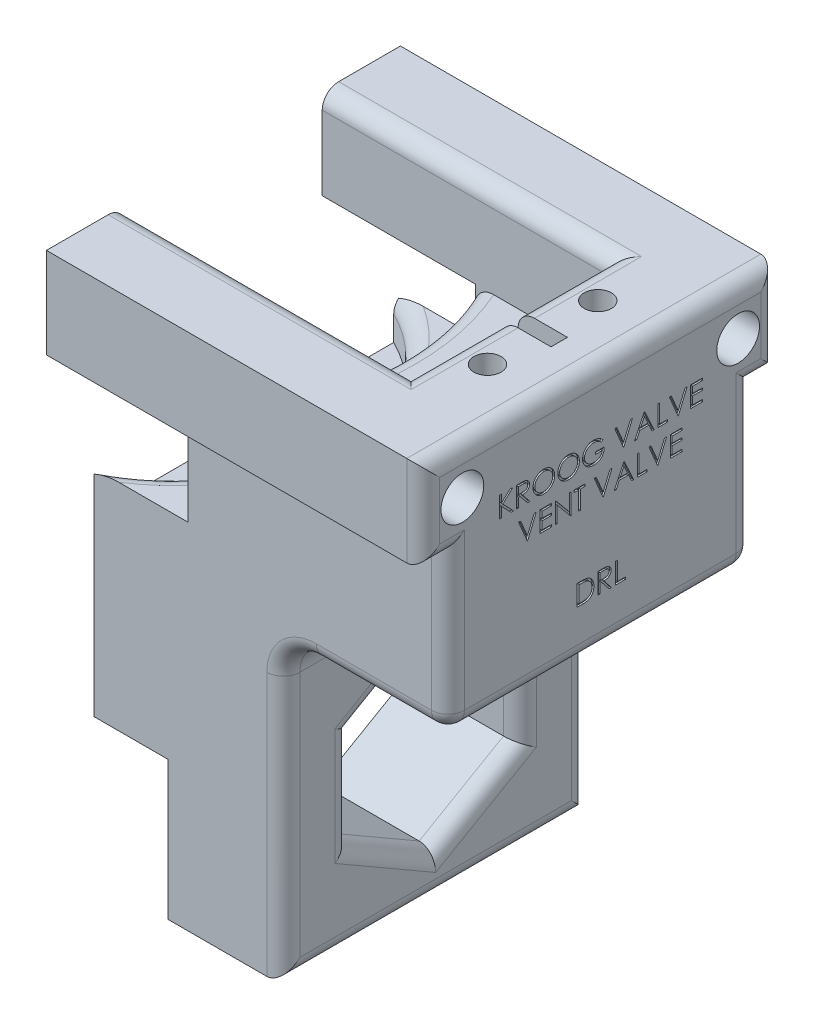
from build123d import *

# Parameters (mm, degrees)
BOSS_EXTRUDE1_DEPTH             = 17.78
BOSS_EXTRUDE2_DEPTH             = 11.43
CUT_EXTRUDE1_START              = -13.97
SKETCH5_R                       = 34.925
CUT_EXTRUDE1_DEPTH              = 15.24
CUT_EXTRUDE2_START              = -35.56
SKETCH5_3_R                     = 25.4
CUT_EXTRUDE2_DEPTH              = 6.35
SKETCH6_W                       = 54.61
SKETCH6_H                       = 13.97
BOSS_EXTRUDE3_DEPTH             = 3.530092
BOSS_EXTRUDE4_DEPTH             = 25.4
SKETCH7_W                       = 44.196
SKETCH7_H                       = 30.48
CUT_EXTRUDE3_DEPTH              = 13.97
SKETCH8_W                       = 7.62
SKETCH8_H                       = 2.54
CUT_EXTRUDE4_DEPTH              = 2.54
TAP_DRILL_FOR_M5X0_8_TAP1_D     = 4.2
TAP_DRILL_FOR_M5X0_8_TAP1_DEPTH = 7.874
TAP_DRILL_FOR_M5X0_8_TAP1_TIP   = 1.2618073
BOSS_EXTRUDE5_DEPTH             = 11.43
FILLET3_R                       = 2.54
FILLET4_R                       = 2.54
FILLET5_R                       = 5.08
FILLET6_R                       = 2.54
FILLET7_R                       = 2.54
SKETCH15_R                      = 3.302
CUT_EXTRUDE7_DEPTH              = 90.579142661
CUT_EXTRUDE8_DEPTH              = 0.254


with BuildPart() as part:
    # Sketch2 → Boss-Extrude1 (new body)
    with BuildSketch(Plane(origin=(0, 0, 0), x_dir=(0, 0, -1), z_dir=(1, 0, 0))):
        Polygon((-23.495, -21.381314258), (23.495, -21.381314258), (23.495, 48.468685742), (27.305, 48.468685742), (27.305, 62.438685742), (23.495, 62.438685742), (-23.495, 62.438685742), (-27.305, 62.438685742), (-27.305, 48.468685742), (-23.495, 48.468685742), align=None)
        Polygon((0, 15.031314258), (-13.0175, 7.515657129), (-13.0175, -7.515657129), (0, -15.031314258), (13.0175, -7.515657129), (13.0175, 7.515657129), align=None, mode=Mode.SUBTRACT)
    extrude(amount=BOSS_EXTRUDE1_DEPTH)

    # Sketch4 → Boss-Extrude2 (add)
    with BuildSketch(Plane.ZY):
        Polygon((-23.495, 16.301314258), (23.495, 16.301314258), (23.495, 48.468685742), (27.305, 48.468685742), (27.305, 62.438685742), (-27.305, 62.438685742), (-27.305, 48.468685742), (-23.495, 48.468685742), align=None)
    extrude(amount=BOSS_EXTRUDE2_DEPTH)

    # Sketch5 → Cut-Extrude1 (cut)
    with BuildSketch(Plane(origin=(0, 62.438685742, 0), x_dir=(1, 0, 0), z_dir=(0, 1, 0)).offset(CUT_EXTRUDE1_START)):
        with Locations((-22.73046, 0)):
            Circle(SKETCH5_R)
    extrude(amount=-CUT_EXTRUDE1_DEPTH, mode=Mode.SUBTRACT)

    # Sketch5<3> → Cut-Extrude2 (cut)
    with BuildSketch(Plane(origin=(0, 62.438685742, 0), x_dir=(1, 0, 0), z_dir=(0, 1, 0)).offset(CUT_EXTRUDE2_START)):
        with Locations((-22.73046, 0)):
            Circle(SKETCH5_3_R)
    extrude(amount=CUT_EXTRUDE2_DEPTH, mode=Mode.SUBTRACT)

    # Sketch6 → Boss-Extrude3 (add)
    with BuildSketch(Plane.ZY.offset(11.43)):
        with Locations((0, 55.453685742)):
            Rectangle(SKETCH6_W, SKETCH6_H)
    extrude(amount=BOSS_EXTRUDE3_DEPTH)

    # Sketch11 → Boss-Extrude4 (add)
    with BuildSketch(Plane(origin=(17.78, 0, 0), x_dir=(0, 0, -1), z_dir=(1, 0, 0))):
        Polygon((-23.495, 48.468685742), (-23.495, 24.338685742), (23.495, 24.338685742), (23.495, 48.468685742), (27.305, 48.468685742), (27.305, 62.438685742), (-27.305, 62.438685742), (-27.305, 48.468685742), align=None)
    extrude(amount=BOSS_EXTRUDE4_DEPTH)

    # Sketch7 → Cut-Extrude3 (cut)
    with BuildSketch(Plane(origin=(0, 62.438685742, 0), x_dir=(1, 0, 0), z_dir=(0, 1, 0))):
        with Locations((7.137908, 0)):
            Rectangle(SKETCH7_W, SKETCH7_H)
    extrude(amount=-CUT_EXTRUDE3_DEPTH, mode=Mode.SUBTRACT)

    # Sketch8 → Cut-Extrude4 (cut)
    with BuildSketch(Plane(origin=(0, 62.438685742, 0), x_dir=(1, 0, 0), z_dir=(0, 1, 0))):
        with Locations((33.045908, 0)):
            Rectangle(SKETCH8_W, SKETCH8_H)
    extrude(amount=-CUT_EXTRUDE4_DEPTH, mode=Mode.SUBTRACT)

    # Tap Drill for M5x0.8 Tap1
    with Locations(Plane(origin=(0, 62.438685742, 0), x_dir=(1, 0, 0), z_dir=(0, 1, 0))):
        with Locations((34.29, -8.509), (34.29, 8.509)):
            Hole(TAP_DRILL_FOR_M5X0_8_TAP1_D / 2, depth=TAP_DRILL_FOR_M5X0_8_TAP1_DEPTH)
            with Locations((0, 0, -(TAP_DRILL_FOR_M5X0_8_TAP1_DEPTH + TAP_DRILL_FOR_M5X0_8_TAP1_TIP / 2))):  # 118° drill point
                Cone(0, TAP_DRILL_FOR_M5X0_8_TAP1_D / 2, TAP_DRILL_FOR_M5X0_8_TAP1_TIP, mode=Mode.SUBTRACT)

    # Sketch12 → Boss-Extrude5 (add)
    with BuildSketch(Plane.ZY):
        with BuildLine():
            Line((-23.495, 16.301314258), (23.495, 16.301314258))
            Line((23.495, 16.301314258), (23.495, 0))
            Line((23.495, 0), (15.494, 0))
            ThreePointArc((15.494, 0), (0, 15.494), (-15.494, 0))
            Line((-15.494, 0), (-23.495, 0))
            Line((-23.495, 0), (-23.495, 16.301314258))
        make_face()
    extrude(amount=BOSS_EXTRUDE5_DEPTH)

    # Fillet3
    fillet3_edges = [part.edges().sort_by_distance(p)[0] for p in [
        (2.66954, 33.228685742, 0),
        (12.19454, 48.468685742, 0),
    ]]
    fillet(fillet3_edges, radius=FILLET3_R)

    # Fillet4
    fillet4_edges = [part.edges().sort_by_distance(p)[0] for p in [
        (-5.715, 0, -15.494),
        (-5.715, 0, 15.494),
        (-11.43, 15.494, 0),
    ]]
    fillet(fillet4_edges, radius=FILLET4_R)

    # Fillet5
    fillet5_edges = [part.edges().sort_by_distance(p)[0] for p in [
        (17.78, 24.338685742, 0),
    ]]
    fillet(fillet5_edges, radius=FILLET5_R)

    # Fillet6
    fillet6_edges = [part.edges().sort_by_distance(p)[0] for p in [
        (17.78, -1.061314258, -23.495),
        (33.02, 24.338685742, -23.495),
        (33.02, 24.338685742, 23.495),
        (43.18, 36.403685742, -23.495),
        (43.18, 48.468685742, -25.4),
        (43.18, 55.453685742, -27.305),
        (43.18, 62.438685742, 0),
        (43.18, 55.453685742, 27.305),
        (43.18, 48.468685742, 25.4),
        (43.18, 36.403685742, 23.495),
        (43.18, 24.338685742, 0),
        (17.78, -1.061314258, 23.495),
        (19.267897552, 22.85078819, -23.495),
        (19.267897552, 22.85078819, 23.495),
        (17.78, 11.273485694, -6.50875),
        (17.78, 11.273485694, 6.50875),
        (17.78, 0, 13.0175),
        (17.78, -11.273485694, 6.50875),
        (17.78, -11.273485694, -6.50875),
        (17.78, 0, -13.0175),
        (17.78, -21.381314258, 0),
    ]]
    fillet(fillet6_edges, radius=FILLET6_R)

    # Fillet7
    fillet7_edges = [part.edges().sort_by_distance(p)[0] for p in [
        (29.235908, 62.438685742, 8.255),
        (7.137908, 62.438685742, 15.24),
        (29.235908, 62.438685742, -8.255),
        (7.137908, 62.438685742, -15.24),
    ]]
    fillet(fillet7_edges, radius=FILLET7_R)

    # Sketch15 → Cut-Extrude7 (cut, through all)
    with BuildSketch(Plane.ZY.offset(14.960092)):
        with Locations((-21.2725, 55.453685742)):
            Circle(SKETCH15_R)
        with Locations(Location((21.2725, 55.453685742, 0), (0, 0, 180))):
            Circle(SKETCH15_R)
    extrude(amount=-CUT_EXTRUDE7_DEPTH, mode=Mode.SUBTRACT)

    # Sketch16 → Cut-Extrude8 (cut)
    # profile 1 of 22: a face of its own
    with BuildSketch(Plane(origin=(43.18, 0, 0), x_dir=(0, 0, -1), z_dir=(1, 0, 0))):
        Polygon((-15.508653846, 52.913685742), (-15.223717949, 52.913685742), (-15.223717949, 51.70461623), (-13.900165264, 52.913685742), (-13.49375, 52.913685742), (-15.053901242, 51.489006254), (-13.371634615, 49.738685742), (-13.751973157, 49.738685742), (-15.223717949, 51.270852208), (-15.223717949, 49.738685742), (-15.508653846, 49.738685742), align=None)
    # profile 2 of 22: a face of its own
    with BuildSketch(Plane(origin=(43.18, 0, 0), x_dir=(0, 0, -1), z_dir=(1, 0, 0))):
        with BuildLine():
            Line((-12.903525641, 52.913685742), (-12.26814403, 52.913685742))
            add(Edge.make_bspline(
                [(-12.26814403, 52.913685742), (-12.22574315, 52.913544603), (-12.144328761, 52.913273601), (-12.027694438, 52.911762516), (-11.921715571, 52.907431493), (-11.826447574, 52.903704421), (-11.741892194, 52.89690816), (-11.667790152, 52.89041243), (-11.60448274, 52.881909181), (-11.566159718, 52.874012119), (-11.548808093, 52.870436543)],
                knots=[0, 0, 0, 0, 1.410062039, 2.707475311, 3.878576406, 4.937260626, 5.877586885, 6.699081471, 7.410979367, 8, 8, 8, 8], degree=3))
            add(Edge.make_bspline(
                [(-11.548808093, 52.870436543), (-11.525579227, 52.864697263), (-11.479617029, 52.853341137), (-11.413440898, 52.829338499), (-11.350381475, 52.801562126), (-11.290700706, 52.768937894), (-11.234697524, 52.731223629), (-11.181794485, 52.689070404), (-11.131751529, 52.642708867), (-11.086592479, 52.590970118), (-11.044012053, 52.536689856), (-11.008099514, 52.477994305), (-10.977141921, 52.416615634), (-10.952494381, 52.351929619), (-10.932647933, 52.284563583), (-10.918654131, 52.213907317), (-10.910261982, 52.140282719), (-10.909407584, 52.090065187), (-10.908974359, 52.064602208)],
                knots=[0, 0, 0, 0, 1.027469482, 2.033020251, 3.019912614, 3.986113645, 4.951240523, 5.91722682, 6.890402269, 7.87763091, 8.8651537, 9.85103654, 10.82876324, 11.815024772, 12.821070561, 13.842952187, 14.906261191, 16, 16, 16, 16], degree=3))
            add(Edge.make_bspline(
                [(-10.908974359, 52.064602208), (-10.91030695, 52.022297506), (-10.912907181, 51.939750075), (-10.937150667, 51.81995199), (-10.976862225, 51.708201683), (-11.031584065, 51.604639861), (-11.101270304, 51.511285205), (-11.185022079, 51.429288149), (-11.282886112, 51.360671942), (-11.373989849, 51.313089755), (-11.454466301, 51.282616188), (-11.520717949, 51.261174634), (-11.592987279, 51.244608423), (-11.670581861, 51.229767446), (-11.753824606, 51.218562695), (-11.842515999, 51.210356141), (-11.936719293, 51.205227111), (-12.00143402, 51.204463292), (-12.034725561, 51.204070357)],
                knots=[0, 0, 0, 0, 1.260483769, 2.459530307, 3.627416485, 4.787058657, 5.939039949, 7.08810263, 8.267026773, 9.491475466, 10.141966685, 10.831826277, 11.566392101, 12.351337768, 13.187381173, 14.07005841, 15.007169909, 16, 16, 16, 16], degree=3))
            Line((-12.034725561, 51.204070357), (-10.868269231, 49.738685742))
            Line((-10.868269231, 49.738685742), (-11.220622997, 49.738685742))
            Line((-11.220622997, 49.738685742), (-12.387079327, 51.204070357))
            Line((-12.387079327, 51.204070357), (-12.618589744, 51.204070357))
            Line((-12.618589744, 51.204070357), (-12.618589744, 49.738685742))
            Line((-12.618589744, 49.738685742), (-12.903525641, 49.738685742))
            Line((-12.903525641, 49.738685742), (-12.903525641, 52.913685742))
        make_face()
        with BuildLine():
            Line((-12.618589744, 52.588044716), (-12.618589744, 51.529711383))
            Line((-12.618589744, 51.529711383), (-12.037269631, 51.525259259))
            add(Edge.make_bspline(
                [(-12.037269631, 51.525259259), (-12.010127882, 51.525247252), (-11.957519441, 51.525223978), (-11.881409552, 51.528846903), (-11.810543451, 51.532968342), (-11.745192197, 51.539272391), (-11.685326596, 51.547396828), (-11.630976572, 51.557559535), (-11.582053403, 51.56939962), (-11.524995443, 51.587725381), (-11.461280875, 51.616759412), (-11.392037337, 51.659000971), (-11.33307093, 51.712131529), (-11.283252584, 51.772886021), (-11.243220885, 51.839684619), (-11.214997808, 51.911726611), (-11.197088592, 51.987193275), (-11.194976269, 52.039061987), (-11.193910256, 52.065238226)],
                knots=[0, 0, 0, 0, 1.146690395, 2.22261258, 3.21895312, 4.145990853, 4.996080663, 5.770904154, 6.481378293, 7.121626537, 8.300444488, 9.431385265, 10.535395872, 11.636531494, 12.74115979, 13.810798291, 14.895190096, 16, 16, 16, 16], degree=3))
            add(Edge.make_bspline(
                [(-11.193910256, 52.065238226), (-11.195000752, 52.090771189), (-11.197161716, 52.141368205), (-11.214804528, 52.215441781), (-11.244639895, 52.285352515), (-11.284846497, 52.350816012), (-11.333831444, 52.410239072), (-11.391269746, 52.461081847), (-11.455590887, 52.503036718), (-11.515708331, 52.529846763), (-11.569442224, 52.546284059), (-11.616096273, 52.557851186), (-11.668811685, 52.567144383), (-11.727844422, 52.574590267), (-11.792942473, 52.580990109), (-11.864434992, 52.585300651), (-11.941847643, 52.587853228), (-11.995502359, 52.587979401), (-12.023277244, 52.588044716)],
                knots=[0, 0, 0, 0, 1.101028733, 2.181837193, 3.264309656, 4.369019818, 5.486613113, 6.575447106, 7.666700264, 8.788928104, 9.402425223, 10.0903467, 10.862060571, 11.710948788, 12.657782767, 13.684531032, 14.801375019, 16, 16, 16, 16], degree=3))
            Line((-12.023277244, 52.588044716), (-12.618589744, 52.588044716))
        make_face(mode=Mode.SUBTRACT)
    # profile 3 of 22: a face of its own
    with BuildSketch(Plane(origin=(43.18, 0, 0), x_dir=(0, 0, -1), z_dir=(1, 0, 0))):
        with BuildLine():
            add(Edge.make_bspline(
                [(-8.73125, 52.995095998), (-8.67245979, 52.993606942), (-8.556990966, 52.990682312), (-8.387287309, 52.96829484), (-8.225276044, 52.929564022), (-8.069637418, 52.877981173), (-7.922233075, 52.80917041), (-7.781953508, 52.725998882), (-7.649132487, 52.627595237), (-7.525560234, 52.514720153), (-7.412478572, 52.39190802), (-7.312850803, 52.260845916), (-7.229355294, 52.122326288), (-7.160788187, 51.976765392), (-7.106995877, 51.824492421), (-7.069876459, 51.664695575), (-7.046165422, 51.498410221), (-7.043393396, 51.384992993), (-7.041987179, 51.327457777)],
                knots=[0, 0, 0, 0, 1.065120563, 2.091984664, 3.0946048, 4.079830382, 5.057816894, 6.036188127, 7.030412546, 8.04752943, 9.064399622, 10.05169764, 11.02544977, 11.989514704, 12.962713494, 13.945757189, 14.957906945, 16, 16, 16, 16], degree=3))
            add(Edge.make_bspline(
                [(-7.041987179, 51.327457777), (-7.04339319, 51.270346379), (-7.046164599, 51.157773198), (-7.069903418, 50.992543073), (-7.107133468, 50.833710799), (-7.160288653, 50.681541528), (-7.228528908, 50.535874738), (-7.312580385, 50.397093716), (-7.411587055, 50.265152963), (-7.524260412, 50.141497903), (-7.6470885, 50.02810734), (-7.7788331, 49.92930236), (-7.916531325, 49.84428119), (-8.061955132, 49.776441714), (-8.21317588, 49.722220044), (-8.371546987, 49.685251586), (-8.536326361, 49.661405483), (-8.648695058, 49.658667258), (-8.705809295, 49.657275485)],
                knots=[0, 0, 0, 0, 1.043624062, 2.057103931, 3.04512605, 4.022047818, 4.998200453, 5.980619268, 6.982898556, 8.009068085, 9.034988726, 10.034168286, 11.015286542, 11.987931943, 12.962482838, 13.94673481, 14.956375938, 16, 16, 16, 16], degree=3))
            add(Edge.make_bspline(
                [(-8.705809295, 49.657275485), (-8.763344213, 49.658681), (-8.876760852, 49.661451645), (-9.043255162, 49.685201919), (-9.203164258, 49.722341531), (-9.356030848, 49.775417948), (-9.501940177, 49.844013579), (-9.64117761, 49.927656122), (-9.773184265, 50.026904029), (-9.896865706, 50.13954085), (-10.01003105, 50.262160758), (-10.108691341, 50.393546118), (-10.192352694, 50.531119282), (-10.260718002, 50.675262036), (-10.314842191, 50.82527756), (-10.351767276, 50.982166536), (-10.375657746, 51.145034516), (-10.378410786, 51.255926288), (-10.379807692, 51.312193354)],
                knots=[0, 0, 0, 0, 1.053102029, 2.075944431, 3.073151272, 4.055350789, 5.033113405, 6.020478099, 7.024410459, 8.052272461, 9.079885166, 10.07527673, 11.055994387, 12.023226415, 12.992069828, 13.970394897, 14.97016774, 16, 16, 16, 16], degree=3))
            add(Edge.make_bspline(
                [(-10.379807692, 51.312193354), (-10.379322702, 51.349960132), (-10.378358838, 51.425017244), (-10.366754946, 51.536474803), (-10.349916831, 51.6461399), (-10.325785096, 51.753700688), (-10.294224084, 51.858893867), (-10.256984031, 51.962444916), (-10.211500028, 52.063304437), (-10.160082583, 52.161950228), (-10.102695086, 52.256844543), (-10.039307799, 52.34654245), (-9.972147143, 52.43179664), (-9.89852035, 52.510397851), (-9.820854004, 52.584632668), (-9.737888189, 52.653360275), (-9.650129153, 52.717200409), (-9.55719928, 52.774731719), (-9.461388416, 52.826764648), (-9.362621625, 52.871415899), (-9.262240307, 52.909739112), (-9.159774305, 52.940800432), (-9.055495719, 52.96532235), (-8.949176957, 52.982020449), (-8.84090272, 52.993653938), (-8.767958167, 52.994613243), (-8.73125, 52.995095998)],
                knots=[0, 0, 0, 0, 1.037015668, 2.060948919, 3.074880161, 4.083647147, 5.086022904, 6.090072063, 7.104153813, 8.122640571, 9.144368836, 10.147691507, 11.138137339, 12.123020368, 13.103399296, 14.087645067, 15.080126199, 16.082011238, 17.087798457, 18.072939717, 19.057185487, 20.037253025, 21.01195951, 21.997135196, 22.992090687, 24, 24, 24, 24], degree=3))
        make_face()
        with BuildLine():
            add(Edge.make_bspline(
                [(-8.717257612, 52.669454972), (-8.74738803, 52.669087679), (-8.807360816, 52.668356604), (-8.896518931, 52.658726633), (-8.984504471, 52.645001663), (-9.071335607, 52.62542414), (-9.156649026, 52.598750464), (-9.241239954, 52.568051926), (-9.32433701, 52.530658508), (-9.405665867, 52.488410412), (-9.484510256, 52.441648176), (-9.558907492, 52.389966645), (-9.629050177, 52.334577813), (-9.694766568, 52.275352418), (-9.755863703, 52.211988851), (-9.813544111, 52.145447712), (-9.865495803, 52.073827068), (-9.913107719, 51.999069056), (-9.95571426, 51.92127105), (-9.993601403, 51.841252104), (-10.02459304, 51.758359488), (-10.049868195, 51.673492502), (-10.070823024, 51.586785557), (-10.084098083, 51.497580894), (-10.093833867, 51.406326757), (-10.094523155, 51.344657503), (-10.094871795, 51.313465389)],
                knots=[0, 0, 0, 0, 1.008559885, 2.007477868, 2.99961109, 3.989939068, 4.984837346, 5.991145699, 7.001802488, 8.033829008, 9.059044045, 10.069351652, 11.065060232, 12.050310815, 13.029377138, 14.011219647, 14.996725999, 15.989392538, 16.977580475, 17.965360261, 18.951710183, 19.937753436, 20.929683414, 21.935841486, 22.955955122, 24, 24, 24, 24], degree=3))
            add(Edge.make_bspline(
                [(-10.094871795, 51.313465389), (-10.093715313, 51.267598232), (-10.091440155, 51.177363343), (-10.071521502, 51.045130813), (-10.04084014, 50.918050725), (-9.995612386, 50.796818421), (-9.939051471, 50.680391822), (-9.869177078, 50.569803755), (-9.78639205, 50.465024334), (-9.692354423, 50.366785054), (-9.589554539, 50.277117789), (-9.480395562, 50.198410982), (-9.366046933, 50.131817398), (-9.246210456, 50.077565654), (-9.121525903, 50.034576392), (-8.991189839, 50.005113634), (-8.856070493, 49.985723042), (-8.763967684, 49.983860899), (-8.717257612, 49.982916511)],
                knots=[0, 0, 0, 0, 1.032063989, 2.030389145, 3.003944642, 3.970395727, 4.937377036, 5.913328081, 6.909231446, 7.93887556, 8.970685674, 9.976071282, 10.964166581, 11.944589148, 12.933237628, 13.927779006, 14.949070134, 16, 16, 16, 16], degree=3))
            add(Edge.make_bspline(
                [(-8.717257612, 49.982916511), (-8.68586185, 49.983347861), (-8.623594624, 49.984203359), (-8.5309794, 49.992820015), (-8.440032694, 50.006637497), (-8.350882069, 50.026531735), (-8.263628704, 50.051430272), (-8.177908418, 50.081010139), (-8.094634255, 50.117913803), (-8.012755688, 50.158688016), (-7.934381954, 50.205170159), (-7.859564864, 50.255097623), (-7.790190225, 50.310404872), (-7.724522996, 50.368750316), (-7.663175021, 50.431310378), (-7.606561157, 50.498003722), (-7.554872037, 50.569251318), (-7.507278201, 50.643895937), (-7.464820955, 50.721906823), (-7.427828487, 50.802215888), (-7.396444867, 50.88462538), (-7.371109724, 50.969254163), (-7.351256483, 51.055941504), (-7.337576842, 51.144803475), (-7.328007901, 51.235662307), (-7.327286652, 51.297115662), (-7.326923077, 51.328093795)],
                knots=[0, 0, 0, 0, 1.047197238, 2.076906641, 3.100256066, 4.114471768, 5.12198147, 6.126382909, 7.136867548, 8.15857795, 9.17633901, 10.174870724, 11.156907918, 12.133735059, 13.104061851, 14.077631395, 15.04955518, 16.038496417, 17.029181396, 18.010275684, 18.986308667, 19.968651475, 20.955262928, 21.950658345, 22.966943676, 24, 24, 24, 24], degree=3))
            add(Edge.make_bspline(
                [(-7.326923077, 51.328093795), (-7.327286944, 51.358860002), (-7.32800874, 51.419890442), (-7.337572271, 51.510115613), (-7.351270936, 51.598338169), (-7.371012821, 51.684211762), (-7.396458318, 51.767758281), (-7.427833967, 51.848899259), (-7.46483206, 51.927936979), (-7.507293807, 52.004676091), (-7.555023875, 52.078313175), (-7.607179367, 52.148709649), (-7.66466079, 52.214543493), (-7.725825827, 52.277439965), (-7.792202273, 52.336057622), (-7.863489454, 52.390415909), (-7.938821933, 52.441826665), (-8.018584497, 52.488204853), (-8.100902226, 52.531034907), (-8.185369888, 52.567729746), (-8.271030571, 52.598910168), (-8.357666445, 52.625504844), (-8.446006718, 52.644924985), (-8.535454477, 52.658739002), (-8.625885969, 52.668353252), (-8.686703747, 52.669086567), (-8.717257612, 52.669454972)],
                knots=[0, 0, 0, 0, 1.02996197, 2.043119294, 3.035359645, 4.018872909, 4.991431989, 5.957985074, 6.929999688, 7.912076566, 8.892894881, 9.867085534, 10.843653904, 11.817741046, 12.803660682, 13.806313499, 14.818574707, 15.856120519, 16.894564902, 17.924820532, 18.937903209, 19.946497019, 20.957711757, 21.963978472, 22.977135795, 24, 24, 24, 24], degree=3))
        make_face(mode=Mode.SUBTRACT)
    # profile 4 of 22: a face of its own
    with BuildSketch(Plane(origin=(43.18, 0, 0), x_dir=(0, 0, -1), z_dir=(1, 0, 0))):
        with BuildLine():
            add(Edge.make_bspline(
                [(-4.904967949, 52.995095998), (-4.846177738, 52.993606942), (-4.730708915, 52.990682312), (-4.561005258, 52.96829484), (-4.398993993, 52.929564022), (-4.243355367, 52.877981173), (-4.095951024, 52.80917041), (-3.955671457, 52.725998882), (-3.822850436, 52.627595237), (-3.699278182, 52.514720153), (-3.58619652, 52.39190802), (-3.486568752, 52.260845916), (-3.403073243, 52.122326288), (-3.334506136, 51.976765392), (-3.280713826, 51.824492421), (-3.243594407, 51.664695575), (-3.219883371, 51.498410221), (-3.217111345, 51.384992993), (-3.215705128, 51.327457777)],
                knots=[0, 0, 0, 0, 1.065120563, 2.091984664, 3.0946048, 4.079830382, 5.057816894, 6.036188127, 7.030412546, 8.04752943, 9.064399622, 10.05169764, 11.02544977, 11.989514704, 12.962713494, 13.945757189, 14.957906945, 16, 16, 16, 16], degree=3))
            add(Edge.make_bspline(
                [(-3.215705128, 51.327457777), (-3.217111138, 51.270346379), (-3.219882547, 51.157773198), (-3.243621367, 50.992543073), (-3.280851417, 50.833710799), (-3.334006601, 50.681541528), (-3.402246857, 50.535874738), (-3.486298334, 50.397093716), (-3.585305003, 50.265152963), (-3.697978361, 50.141497903), (-3.820806449, 50.02810734), (-3.952551048, 49.92930236), (-4.090249274, 49.84428119), (-4.235673081, 49.776441714), (-4.386893829, 49.722220044), (-4.545264936, 49.685251586), (-4.71004431, 49.661405483), (-4.822413006, 49.658667258), (-4.879527244, 49.657275485)],
                knots=[0, 0, 0, 0, 1.043624062, 2.057103931, 3.04512605, 4.022047818, 4.998200453, 5.980619268, 6.982898556, 8.009068085, 9.034988726, 10.034168286, 11.015286542, 11.987931943, 12.962482838, 13.94673481, 14.956375938, 16, 16, 16, 16], degree=3))
            add(Edge.make_bspline(
                [(-4.879527244, 49.657275485), (-4.937062162, 49.658681), (-5.0504788, 49.661451645), (-5.216973111, 49.685201919), (-5.376882207, 49.722341531), (-5.529748797, 49.775417948), (-5.675658126, 49.844013579), (-5.814895558, 49.927656122), (-5.946902213, 50.026904029), (-6.070583655, 50.13954085), (-6.183748999, 50.262160758), (-6.28240929, 50.393546118), (-6.366070642, 50.531119282), (-6.434435951, 50.675262036), (-6.488560139, 50.82527756), (-6.525485224, 50.982166536), (-6.549375695, 51.145034516), (-6.552128734, 51.255926288), (-6.553525641, 51.312193354)],
                knots=[0, 0, 0, 0, 1.053102029, 2.075944431, 3.073151272, 4.055350789, 5.033113405, 6.020478099, 7.024410459, 8.052272461, 9.079885166, 10.07527673, 11.055994387, 12.023226415, 12.992069828, 13.970394897, 14.97016774, 16, 16, 16, 16], degree=3))
            add(Edge.make_bspline(
                [(-6.553525641, 51.312193354), (-6.55304065, 51.349960132), (-6.552076787, 51.425017244), (-6.540472895, 51.536474803), (-6.52363478, 51.6461399), (-6.499503045, 51.753700688), (-6.467942033, 51.858893867), (-6.430701979, 51.962444916), (-6.385217977, 52.063304437), (-6.333800532, 52.161950228), (-6.276413035, 52.256844543), (-6.213025748, 52.34654245), (-6.145865092, 52.43179664), (-6.072238299, 52.510397851), (-5.994571952, 52.584632668), (-5.911606138, 52.653360275), (-5.823847102, 52.717200409), (-5.730917229, 52.774731719), (-5.635106365, 52.826764648), (-5.536339574, 52.871415899), (-5.435958255, 52.909739112), (-5.333492253, 52.940800432), (-5.229213667, 52.96532235), (-5.122894906, 52.982020449), (-5.014620669, 52.993653938), (-4.941676115, 52.994613243), (-4.904967949, 52.995095998)],
                knots=[0, 0, 0, 0, 1.037015668, 2.060948919, 3.074880161, 4.083647147, 5.086022904, 6.090072063, 7.104153813, 8.122640571, 9.144368836, 10.147691507, 11.138137339, 12.123020368, 13.103399296, 14.087645067, 15.080126199, 16.082011238, 17.087798457, 18.072939717, 19.057185487, 20.037253025, 21.01195951, 21.997135196, 22.992090687, 24, 24, 24, 24], degree=3))
        make_face()
        with BuildLine():
            add(Edge.make_bspline(
                [(-4.890975561, 52.669454972), (-4.921105978, 52.669087679), (-4.981078765, 52.668356604), (-5.07023688, 52.658726633), (-5.15822242, 52.645001663), (-5.245053555, 52.62542414), (-5.330366975, 52.598750464), (-5.414957902, 52.568051926), (-5.498054958, 52.530658508), (-5.579383815, 52.488410412), (-5.658228205, 52.441648176), (-5.732625441, 52.389966645), (-5.802768125, 52.334577813), (-5.868484517, 52.275352418), (-5.929581652, 52.211988851), (-5.98726206, 52.145447712), (-6.039213752, 52.073827068), (-6.086825668, 51.999069056), (-6.129432209, 51.92127105), (-6.167319352, 51.841252104), (-6.198310988, 51.758359488), (-6.223586144, 51.673492502), (-6.244540972, 51.586785557), (-6.257816032, 51.497580894), (-6.267551815, 51.406326757), (-6.268241104, 51.344657503), (-6.268589744, 51.313465389)],
                knots=[0, 0, 0, 0, 1.008559885, 2.007477868, 2.99961109, 3.989939068, 4.984837346, 5.991145699, 7.001802488, 8.033829008, 9.059044045, 10.069351652, 11.065060232, 12.050310815, 13.029377138, 14.011219647, 14.996725999, 15.989392538, 16.977580475, 17.965360261, 18.951710183, 19.937753436, 20.929683414, 21.935841486, 22.955955122, 24, 24, 24, 24], degree=3))
            add(Edge.make_bspline(
                [(-6.268589744, 51.313465389), (-6.267433262, 51.267598232), (-6.265158104, 51.177363343), (-6.245239451, 51.045130813), (-6.214558089, 50.918050725), (-6.169330335, 50.796818421), (-6.11276942, 50.680391822), (-6.042895027, 50.569803755), (-5.960109999, 50.465024334), (-5.866072371, 50.366785054), (-5.763272487, 50.277117789), (-5.654113511, 50.198410982), (-5.539764881, 50.131817398), (-5.419928405, 50.077565654), (-5.295243851, 50.034576392), (-5.164907787, 50.005113634), (-5.029788442, 49.985723042), (-4.937685633, 49.983860899), (-4.890975561, 49.982916511)],
                knots=[0, 0, 0, 0, 1.032063989, 2.030389145, 3.003944642, 3.970395727, 4.937377036, 5.913328081, 6.909231446, 7.93887556, 8.970685674, 9.976071282, 10.964166581, 11.944589148, 12.933237628, 13.927779006, 14.949070134, 16, 16, 16, 16], degree=3))
            add(Edge.make_bspline(
                [(-4.890975561, 49.982916511), (-4.859579799, 49.983347861), (-4.797312573, 49.984203359), (-4.704697349, 49.992820015), (-4.613750643, 50.006637497), (-4.524600017, 50.026531735), (-4.437346653, 50.051430272), (-4.351626367, 50.081010139), (-4.268352204, 50.117913803), (-4.186473637, 50.158688016), (-4.108099903, 50.205170159), (-4.033282813, 50.255097623), (-3.963908174, 50.310404872), (-3.898240945, 50.368750316), (-3.83689297, 50.431310378), (-3.780279106, 50.498003722), (-3.728589986, 50.569251318), (-3.680996149, 50.643895937), (-3.638538904, 50.721906823), (-3.601546435, 50.802215888), (-3.570162816, 50.88462538), (-3.544827672, 50.969254163), (-3.524974432, 51.055941504), (-3.511294791, 51.144803475), (-3.50172585, 51.235662307), (-3.501004601, 51.297115662), (-3.500641026, 51.328093795)],
                knots=[0, 0, 0, 0, 1.047197238, 2.076906641, 3.100256066, 4.114471768, 5.12198147, 6.126382909, 7.136867548, 8.15857795, 9.17633901, 10.174870724, 11.156907918, 12.133735059, 13.104061851, 14.077631395, 15.04955518, 16.038496417, 17.029181396, 18.010275684, 18.986308667, 19.968651475, 20.955262928, 21.950658345, 22.966943676, 24, 24, 24, 24], degree=3))
            add(Edge.make_bspline(
                [(-3.500641026, 51.328093795), (-3.501004892, 51.358860002), (-3.501726689, 51.419890442), (-3.51129022, 51.510115613), (-3.524988885, 51.598338169), (-3.54473077, 51.684211762), (-3.570176266, 51.767758281), (-3.601551916, 51.848899259), (-3.638550009, 51.927936979), (-3.681011756, 52.004676091), (-3.728741824, 52.078313175), (-3.780897316, 52.148709649), (-3.838378739, 52.214543493), (-3.899543776, 52.277439965), (-3.965920222, 52.336057622), (-4.037207403, 52.390415909), (-4.112539882, 52.441826665), (-4.192302446, 52.488204853), (-4.274620175, 52.531034907), (-4.359087837, 52.567729746), (-4.44474852, 52.598910168), (-4.531384394, 52.625504844), (-4.619724667, 52.644924985), (-4.709172426, 52.658739002), (-4.799603917, 52.668353252), (-4.860421695, 52.669086567), (-4.890975561, 52.669454972)],
                knots=[0, 0, 0, 0, 1.02996197, 2.043119294, 3.035359645, 4.018872909, 4.991431989, 5.957985074, 6.929999688, 7.912076566, 8.892894881, 9.867085534, 10.843653904, 11.817741046, 12.803660682, 13.806313499, 14.818574707, 15.856120519, 16.894564902, 17.924820532, 18.937903209, 19.946497019, 20.957711757, 21.963978472, 22.977135795, 24, 24, 24, 24], degree=3))
        make_face(mode=Mode.SUBTRACT)
    # profile 5 of 22: a face of its own
    with BuildSketch(Plane(origin=(43.18, 0, 0), x_dir=(0, 0, -1), z_dir=(1, 0, 0))):
        with BuildLine():
            Line((0.407051282, 52.371798722), (0.162820513, 52.140288306))
            add(Edge.make_bspline(
                [(0.162820513, 52.140288306), (0.118625521, 52.181863446), (0.031289394, 52.264022343), (-0.111095969, 52.370621603), (-0.25965298, 52.461940136), (-0.41360646, 52.536240794), (-0.569143862, 52.595525084), (-0.724200681, 52.637732754), (-0.877186424, 52.664649984), (-0.978938115, 52.667868862), (-1.029076522, 52.669454972)],
                knots=[0, 0, 0, 0, 1.08915593, 2.152340314, 3.188132944, 4.216796309, 5.218260357, 6.173443236, 7.099959455, 8, 8, 8, 8], degree=3))
            add(Edge.make_bspline(
                [(-1.029076522, 52.669454972), (-1.059842, 52.669079773), (-1.121293164, 52.668330347), (-1.212571642, 52.658765237), (-1.302892806, 52.645008539), (-1.392086153, 52.625104121), (-1.480325105, 52.599877332), (-1.567302772, 52.568321947), (-1.653181401, 52.531532547), (-1.73715206, 52.489021589), (-1.818559517, 52.442322014), (-1.895446075, 52.390570838), (-1.968301801, 52.335426721), (-2.03575733, 52.275509047), (-2.098200678, 52.211360562), (-2.157118129, 52.144174563), (-2.210437533, 52.072115472), (-2.258598804, 51.996509082), (-2.301562558, 51.918683311), (-2.33948898, 51.839387241), (-2.371327053, 51.758883888), (-2.396517916, 51.677072232), (-2.417301152, 51.594585196), (-2.431922124, 51.510851629), (-2.440165079, 51.425781871), (-2.441590908, 51.368815787), (-2.442307692, 51.340178129)],
                knots=[0, 0, 0, 0, 1.02818874, 2.053710826, 3.065248034, 4.081641283, 5.106893873, 6.131558223, 7.173050175, 8.228653731, 9.27666206, 10.308777013, 11.325269123, 12.329503258, 13.32196095, 14.316845687, 15.314881793, 16.315733098, 17.311955233, 18.285320748, 19.252783886, 20.203351036, 21.145449891, 22.095197417, 23.042428769, 24, 24, 24, 24], degree=3))
            add(Edge.make_bspline(
                [(-2.442307692, 51.340178129), (-2.441622148, 51.310903888), (-2.440252931, 51.252435344), (-2.431489641, 51.165173578), (-2.415226166, 51.07920782), (-2.39348403, 50.994255585), (-2.366287147, 50.910171381), (-2.3323848, 50.827319748), (-2.292229577, 50.74570375), (-2.245750705, 50.666058769), (-2.194781791, 50.588477169), (-2.137683425, 50.515398174), (-2.077031324, 50.445848641), (-2.010615858, 50.381372769), (-1.940566702, 50.320245949), (-1.864790994, 50.264152297), (-1.784778762, 50.212011337), (-1.700407935, 50.164480209), (-1.612593982, 50.12201818), (-1.522553927, 50.08425936), (-1.430000123, 50.053163104), (-1.335418969, 50.027819253), (-1.238923215, 50.007045412), (-1.140023051, 49.993680947), (-1.039445666, 49.983982836), (-0.97164705, 49.98327375), (-0.937489984, 49.982916511)],
                knots=[0, 0, 0, 0, 0.93586088, 1.869166235, 2.799637598, 3.729985548, 4.670839027, 5.622275134, 6.589130586, 7.576015415, 8.568469353, 9.55398029, 10.53834874, 11.515998671, 12.510579167, 13.508179873, 14.527009472, 15.561807829, 16.601455013, 17.643573243, 18.680854198, 19.719860599, 20.772568776, 21.833555941, 22.908541556, 24, 24, 24, 24], degree=3))
            add(Edge.make_bspline(
                [(-0.937489984, 49.982916511), (-0.89632534, 49.983777005), (-0.815491875, 49.985466725), (-0.696668459, 49.998620559), (-0.582547102, 50.019164436), (-0.473448475, 50.049250643), (-0.369245863, 50.087626119), (-0.269557266, 50.13388622), (-0.175167547, 50.189805281), (-0.085792954, 50.252918717), (-0.003463222, 50.323235744), (0.070790162, 50.399113214), (0.135782856, 50.480182817), (0.192483548, 50.565967067), (0.239390684, 50.657176023), (0.277892362, 50.753362704), (0.307404705, 50.854570376), (0.319519576, 50.924503499), (0.325641026, 50.959839588)],
                knots=[0, 0, 0, 0, 1.13008108, 2.219097802, 3.278683437, 4.311054135, 5.322181354, 6.324827112, 7.324222904, 8.330512327, 9.32562643, 10.293043162, 11.24128371, 12.174520618, 13.111833804, 14.052305215, 15.015860969, 16, 16, 16, 16], degree=3))
            Line((0.325641026, 50.959839588), (-0.732692308, 50.959839588))
            Line((-0.732692308, 50.959839588), (-0.732692308, 51.285480613))
            Line((-0.732692308, 51.285480613), (0.610576923, 51.285480613))
            add(Edge.make_bspline(
                [(0.610576923, 51.285480613), (0.609029475, 51.224785963), (0.606000839, 51.105995568), (0.584756537, 50.932758251), (0.550451558, 50.769135358), (0.503588275, 50.614954571), (0.442922843, 50.470434383), (0.369106335, 50.335428062), (0.280957339, 50.210807787), (0.181615724, 50.095556191), (0.070127905, 49.992750406), (-0.050493628, 49.902393591), (-0.180448164, 49.826281932), (-0.319612775, 49.76435976), (-0.467531883, 49.716032636), (-0.62454777, 49.68176842), (-0.790447508, 49.66123981), (-0.904145779, 49.658616916), (-0.962294671, 49.657275485)],
                knots=[0, 0, 0, 0, 1.140356446, 2.231883559, 3.274166699, 4.278491846, 5.25512956, 6.21435461, 7.1637429, 8.11826594, 9.068280886, 10.0076534, 10.945064095, 11.891975133, 12.864533718, 13.863980011, 14.907571808, 16, 16, 16, 16], degree=3))
            add(Edge.make_bspline(
                [(-0.962294671, 49.657275485), (-0.998136009, 49.657791759), (-1.068826677, 49.658810019), (-1.17323059, 49.666046612), (-1.27475586, 49.67718685), (-1.373387697, 49.694009926), (-1.469488907, 49.714615362), (-1.562579531, 49.741001171), (-1.653014182, 49.771543491), (-1.740932641, 49.806283138), (-1.825536908, 49.846534569), (-1.90720382, 49.891265457), (-1.986384806, 49.940245148), (-2.062540505, 49.994320701), (-2.136067719, 50.053087647), (-2.206492343, 50.116663774), (-2.274208632, 50.184854718), (-2.316627053, 50.233277105), (-2.338000801, 50.257676126)],
                knots=[0, 0, 0, 0, 1.107784379, 2.184907829, 3.233506516, 4.263428166, 5.276301166, 6.270063455, 7.25232949, 8.225834625, 9.190232166, 10.146266622, 11.1027726, 12.066435141, 13.031522626, 14.010570082, 14.99756817, 16, 16, 16, 16], degree=3))
            add(Edge.make_bspline(
                [(-2.338000801, 50.257676126), (-2.369012325, 50.296384504), (-2.430520614, 50.373158741), (-2.50969437, 50.496167262), (-2.577187071, 50.623531807), (-2.63194931, 50.755606934), (-2.674710288, 50.892269106), (-2.705377389, 51.033343691), (-2.72334543, 51.179012356), (-2.725933996, 51.277587275), (-2.72724359, 51.327457777)],
                knots=[0, 0, 0, 0, 1.023165419, 2.029347347, 3.013907458, 3.994755782, 4.975994455, 5.96558838, 6.970761222, 8, 8, 8, 8], degree=3))
            add(Edge.make_bspline(
                [(-2.72724359, 51.327457777), (-2.726760774, 51.364801449), (-2.725801278, 51.439014178), (-2.714166703, 51.549193307), (-2.697473988, 51.657416078), (-2.672938445, 51.763594025), (-2.642008262, 51.867798062), (-2.603406171, 51.970076572), (-2.558461873, 52.070489913), (-2.506223601, 52.168346921), (-2.448089842, 52.262349067), (-2.384997856, 52.352117932), (-2.316051733, 52.436018726), (-2.242377401, 52.515114007), (-2.163095845, 52.588410104), (-2.078949797, 52.656585619), (-1.989874407, 52.719732002), (-1.895589444, 52.776854638), (-1.797502187, 52.828165922), (-1.695847757, 52.873150421), (-1.590657185, 52.910328143), (-1.482718545, 52.941872929), (-1.371214812, 52.965200235), (-1.256955147, 52.982117311), (-1.139343973, 52.993692998), (-1.059845575, 52.994623959), (-1.019536258, 52.995095998)],
                knots=[0, 0, 0, 0, 1.008945113, 2.00506715, 2.99143336, 3.967273523, 4.948097931, 5.927297278, 6.919902385, 7.919676788, 8.923139349, 9.905703106, 10.883022732, 11.856032218, 12.825136022, 13.798837087, 14.781400844, 15.773989409, 16.776158564, 17.77167057, 18.775803737, 19.789618931, 20.80898985, 21.851988756, 22.910860228, 24, 24, 24, 24], degree=3))
            add(Edge.make_bspline(
                [(-1.019536258, 52.995095998), (-0.986662994, 52.994570316), (-0.921479175, 52.993527951), (-0.824482261, 52.986302877), (-0.728984597, 52.974851214), (-0.634844586, 52.959224057), (-0.542382811, 52.937939138), (-0.451335871, 52.912468123), (-0.361571785, 52.882811969), (-0.273371873, 52.847443516), (-0.186143088, 52.807299156), (-0.099400418, 52.762111266), (-0.013440245, 52.711107155), (0.071886502, 52.654135376), (0.157117888, 52.592174418), (0.240905813, 52.523452157), (0.32527277, 52.450678657), (0.379521558, 52.398352676), (0.407051282, 52.371798722)],
                knots=[0, 0, 0, 0, 0.985871117, 1.954866573, 2.915460327, 3.869826059, 4.81536089, 5.759505086, 6.70452669, 7.649098992, 8.607881297, 9.583363685, 10.581137262, 11.603961102, 12.659522466, 13.73993555, 14.853081303, 16, 16, 16, 16], degree=3))
        make_face()
    # profile 6 of 22: a face of its own
    with BuildSketch(Plane(origin=(43.18, 0, 0), x_dir=(0, 0, -1), z_dir=(1, 0, 0))):
        Polygon((2.238782051, 52.913685742), (2.544070513, 52.913685742), (3.601767829, 50.413500445), (4.660101162, 52.913685742), (4.966025641, 52.913685742), (3.62275641, 49.738685742), (3.582051282, 49.738685742), align=None)
    # profile 7 of 22: a face of its own
    with BuildSketch(Plane(origin=(43.18, 0, 0), x_dir=(0, 0, -1), z_dir=(1, 0, 0))):
        Polygon((6.838461538, 52.913685742), (8.303846154, 49.738685742), (7.994105569, 49.738685742), (7.524724559, 50.756313947), (6.085416667, 50.756313947), (5.603315304, 49.738685742), (5.291666667, 49.738685742), (6.79775641, 52.913685742), align=None)
        Polygon((6.814928886, 52.294204572), (6.240604968, 51.081954972), (7.374624399, 51.081954972), align=None, mode=Mode.SUBTRACT)
    # profile 8 of 22: a face of its own
    with BuildSketch(Plane(origin=(43.18, 0, 0), x_dir=(0, 0, -1), z_dir=(1, 0, 0))):
        Polygon((8.873717949, 52.913685742), (9.158653846, 52.913685742), (9.158653846, 50.064326767), (10.379807692, 50.064326767), (10.379807692, 49.738685742), (8.873717949, 49.738685742), align=None)
    # profile 9 of 22: a face of its own
    with BuildSketch(Plane(origin=(43.18, 0, 0), x_dir=(0, 0, -1), z_dir=(1, 0, 0))):
        Polygon((10.66474359, 52.913685742), (10.970032051, 52.913685742), (12.027729367, 50.413500445), (13.0860627, 52.913685742), (13.391987179, 52.913685742), (12.048717949, 49.738685742), (12.008012821, 49.738685742), align=None)
    # profile 10 of 22: a face of its own
    with BuildSketch(Plane(origin=(43.18, 0, 0), x_dir=(0, 0, -1), z_dir=(1, 0, 0))):
        Polygon((13.961858974, 52.913685742), (15.752884615, 52.913685742), (15.752884615, 52.588044716), (14.246794872, 52.588044716), (14.246794872, 51.611121639), (15.752884615, 51.611121639), (15.752884615, 51.285480613), (14.246794872, 51.285480613), (14.246794872, 50.064326767), (15.752884615, 50.064326767), (15.752884615, 49.738685742), (13.961858974, 49.738685742), align=None)
    # profile 11 of 22: a face of its own
    with BuildSketch(Plane(origin=(43.18, 0, 0), x_dir=(0, 0, -1), z_dir=(1, 0, 0))):
        Polygon((-12.598237179, 47.833685742), (-12.292948718, 47.833685742), (-11.235251402, 45.333500445), (-10.176918069, 47.833685742), (-9.87099359, 47.833685742), (-11.214262821, 44.658685742), (-11.254967949, 44.658685742), align=None)
    # profile 12 of 22: a face of its own
    with BuildSketch(Plane(origin=(43.18, 0, 0), x_dir=(0, 0, -1), z_dir=(1, 0, 0))):
        Polygon((-9.301121795, 47.833685742), (-7.510096154, 47.833685742), (-7.510096154, 47.508044716), (-9.016185897, 47.508044716), (-9.016185897, 46.531121639), (-7.510096154, 46.531121639), (-7.510096154, 46.205480613), (-9.016185897, 46.205480613), (-9.016185897, 44.984326767), (-7.510096154, 44.984326767), (-7.510096154, 44.658685742), (-9.301121795, 44.658685742), align=None)
    # profile 13 of 22: a face of its own
    with BuildSketch(Plane(origin=(43.18, 0, 0), x_dir=(0, 0, -1), z_dir=(1, 0, 0))):
        Polygon((-6.940224359, 44.658685742), (-6.940224359, 47.833685742), (-6.880438702, 47.833685742), (-4.782852564, 45.33477248), (-4.782852564, 47.833685742), (-4.497916667, 47.833685742), (-4.497916667, 44.658685742), (-4.562790465, 44.658685742), (-6.655288462, 47.151874844), (-6.655288462, 44.658685742), align=None)
    # profile 14 of 22: a face of its own
    with BuildSketch(Plane(origin=(43.18, 0, 0), x_dir=(0, 0, -1), z_dir=(1, 0, 0))):
        Polygon((-4.050160256, 47.508044716), (-4.050160256, 47.833685742), (-2.38125, 47.833685742), (-2.38125, 47.508044716), (-3.073237179, 47.508044716), (-3.073237179, 44.658685742), (-3.358173077, 44.658685742), (-3.358173077, 47.508044716), align=None)
    # profile 15 of 22: a face of its own
    with BuildSketch(Plane(origin=(43.18, 0, 0), x_dir=(0, 0, -1), z_dir=(1, 0, 0))):
        Polygon((-0.915865385, 47.833685742), (-0.610576923, 47.833685742), (0.447120393, 45.333500445), (1.505453726, 47.833685742), (1.811378205, 47.833685742), (0.468108974, 44.658685742), (0.427403846, 44.658685742), align=None)
    # profile 16 of 22: a face of its own
    with BuildSketch(Plane(origin=(43.18, 0, 0), x_dir=(0, 0, -1), z_dir=(1, 0, 0))):
        Polygon((3.683814103, 47.833685742), (5.149198718, 44.658685742), (4.839458133, 44.658685742), (4.370077123, 45.676313947), (2.930769231, 45.676313947), (2.448667869, 44.658685742), (2.137019231, 44.658685742), (3.643108974, 47.833685742), align=None)
        Polygon((3.66028145, 47.214204572), (3.085957532, 46.001954972), (4.219976963, 46.001954972), align=None, mode=Mode.SUBTRACT)
    # profile 17 of 22: a face of its own
    with BuildSketch(Plane(origin=(43.18, 0, 0), x_dir=(0, 0, -1), z_dir=(1, 0, 0))):
        Polygon((5.719070513, 47.833685742), (6.00400641, 47.833685742), (6.00400641, 44.984326767), (7.225160256, 44.984326767), (7.225160256, 44.658685742), (5.719070513, 44.658685742), align=None)
    # profile 18 of 22: a face of its own
    with BuildSketch(Plane(origin=(43.18, 0, 0), x_dir=(0, 0, -1), z_dir=(1, 0, 0))):
        Polygon((7.510096154, 47.833685742), (7.815384615, 47.833685742), (8.873081931, 45.333500445), (9.931415264, 47.833685742), (10.237339744, 47.833685742), (8.894070513, 44.658685742), (8.853365385, 44.658685742), align=None)
    # profile 19 of 22: a face of its own
    with BuildSketch(Plane(origin=(43.18, 0, 0), x_dir=(0, 0, -1), z_dir=(1, 0, 0))):
        Polygon((10.807211538, 47.833685742), (12.598237179, 47.833685742), (12.598237179, 47.508044716), (11.092147436, 47.508044716), (11.092147436, 46.531121639), (12.598237179, 46.531121639), (12.598237179, 46.205480613), (11.092147436, 46.205480613), (11.092147436, 44.984326767), (12.598237179, 44.984326767), (12.598237179, 44.658685742), (10.807211538, 44.658685742), align=None)
    # profile 20 of 22: a face of its own
    with BuildSketch(Plane(origin=(43.18, 0, 0), x_dir=(0, 0, -1), z_dir=(1, 0, 0))):
        with BuildLine():
            Line((-3.582051282, 31.958685742), (-3.582051282, 35.133685742))
            Line((-3.582051282, 35.133685742), (-2.940945513, 35.133685742))
            add(Edge.make_bspline(
                [(-2.940945513, 35.133685742), (-2.885184359, 35.133284267), (-2.777454101, 35.132508621), (-2.621777095, 35.127590645), (-2.477737539, 35.118890723), (-2.34580916, 35.106218367), (-2.225629774, 35.090658115), (-2.117535894, 35.071154177), (-2.020968593, 35.048123479), (-1.961578458, 35.028487964), (-1.93349359, 35.019202569)],
                knots=[0, 0, 0, 0, 1.314313732, 2.53924729, 3.670748893, 4.714932338, 5.66265055, 6.526160246, 7.303039223, 8, 8, 8, 8], degree=3))
            add(Edge.make_bspline(
                [(-1.93349359, 35.019202569), (-1.896759076, 35.005204714), (-1.824123066, 34.97752643), (-1.720702319, 34.925314643), (-1.623342883, 34.866157043), (-1.531522659, 34.799975653), (-1.447339052, 34.724896566), (-1.367503317, 34.644109067), (-1.295281389, 34.554675358), (-1.229143149, 34.45845019), (-1.169511515, 34.356567115), (-1.117678136, 34.249220266), (-1.074630585, 34.136954799), (-1.038895301, 34.020082914), (-1.010731729, 33.898347629), (-0.99151669, 33.771607193), (-0.978843007, 33.6403625), (-0.977569332, 33.551304236), (-0.976923077, 33.506116631)],
                knots=[0, 0, 0, 0, 0.984719456, 1.947108742, 2.898477687, 3.838006223, 4.779231079, 5.722358779, 6.681677486, 7.655904652, 8.64651281, 9.637519902, 10.640069247, 11.656948941, 12.698408672, 13.768548281, 14.867775369, 16, 16, 16, 16], degree=3))
            add(Edge.make_bspline(
                [(-0.976923077, 33.506116631), (-0.97749364, 33.466872508), (-0.978617995, 33.389537863), (-0.988713874, 33.275563622), (-1.003388108, 33.164970597), (-1.026106773, 33.058285426), (-1.053686196, 32.9545734), (-1.089032247, 32.854939864), (-1.129523019, 32.758470837), (-1.176739694, 32.666470698), (-1.228575093, 32.579309353), (-1.284202675, 32.49714441), (-1.343563106, 32.421148316), (-1.40722243, 32.351090932), (-1.474358001, 32.287077872), (-1.545409358, 32.2285744), (-1.62055984, 32.17672524), (-1.699472853, 32.129492935), (-1.784450484, 32.088290184), (-1.877102306, 32.053428675), (-1.977823446, 32.024539245), (-2.086366678, 32.000435647), (-2.202919547, 31.981315522), (-2.327596323, 31.968500866), (-2.46020545, 31.959834992), (-2.551263784, 31.959076263), (-2.598132011, 31.958685742)],
                knots=[0, 0, 0, 0, 1.105936401, 2.179363191, 3.223086493, 4.248585256, 5.251745608, 6.245858792, 7.225916811, 8.198733463, 9.158002045, 10.082870192, 10.993790845, 11.873723703, 12.748670949, 13.606408763, 14.465103618, 15.319838547, 16.196477973, 17.123216899, 18.106603292, 19.147568657, 20.255746949, 21.433717677, 22.679120308, 24, 24, 24, 24], degree=3))
            Line((-2.598132011, 31.958685742), (-3.582051282, 31.958685742))
        make_face()
        with BuildLine():
            Line((-3.297115385, 32.284326767), (-2.932677284, 32.284326767))
            add(Edge.make_bspline(
                [(-2.932677284, 32.284326767), (-2.880309404, 32.284551826), (-2.779586794, 32.284984697), (-2.634754183, 32.288783088), (-2.50242073, 32.294989703), (-2.382567647, 32.303675666), (-2.275262603, 32.31516791), (-2.180281344, 32.327981215), (-2.097935217, 32.343944617), (-2.048106371, 32.358414415), (-2.025080128, 32.365101006)],
                knots=[0, 0, 0, 0, 1.375205317, 2.645023457, 3.804390687, 4.853969522, 5.800190428, 6.637939096, 7.370582563, 8, 8, 8, 8], degree=3))
            add(Edge.make_bspline(
                [(-2.025080128, 32.365101006), (-1.9960984, 32.375307777), (-1.938827171, 32.39547753), (-1.856385044, 32.432269122), (-1.779498332, 32.475850143), (-1.706827095, 32.524293634), (-1.6394022, 32.579308222), (-1.576424609, 32.639697619), (-1.518021118, 32.705769165), (-1.464795139, 32.777440854), (-1.417162606, 32.854266597), (-1.375913705, 32.935491111), (-1.339762672, 33.020224431), (-1.311388521, 33.10976774), (-1.289149383, 33.203320528), (-1.273397131, 33.300889379), (-1.263586631, 33.40245607), (-1.262442317, 33.471536926), (-1.261858974, 33.506752649)],
                knots=[0, 0, 0, 0, 0.998632004, 1.973411704, 2.929992603, 3.868527914, 4.809262121, 5.754881198, 6.702106254, 7.672490631, 8.653608572, 9.636854334, 10.631411391, 11.644891563, 12.686317036, 13.754757253, 14.855430412, 16, 16, 16, 16], degree=3))
            add(Edge.make_bspline(
                [(-1.261858974, 33.506752649), (-1.262324599, 33.543885163), (-1.263239324, 33.616832316), (-1.274736734, 33.723866732), (-1.291538431, 33.826809894), (-1.31583506, 33.925668685), (-1.346796643, 34.020635976), (-1.385436068, 34.111186532), (-1.429583644, 34.198276663), (-1.482110243, 34.279896266), (-1.539637245, 34.357087872), (-1.603480036, 34.427804117), (-1.672624313, 34.49220609), (-1.746315927, 34.551296752), (-1.826631724, 34.602698801), (-1.911679715, 34.648678861), (-2.002707574, 34.68770042), (-2.066037662, 34.708454817), (-2.098222155, 34.719002248)],
                knots=[0, 0, 0, 0, 1.122418816, 2.205001699, 3.251619955, 4.274784885, 5.280384055, 6.268708349, 7.249350384, 8.229342522, 9.199999885, 10.157847722, 11.105861043, 12.055065948, 13.010012805, 13.98527497, 14.976112212, 16, 16, 16, 16], degree=3))
            add(Edge.make_bspline(
                [(-2.098222155, 34.719002248), (-2.124847838, 34.726365008), (-2.181461345, 34.742020255), (-2.273844287, 34.759097557), (-2.377816602, 34.774160209), (-2.493839902, 34.786912859), (-2.621781933, 34.796063501), (-2.761741092, 34.802931765), (-2.913777877, 34.80756421), (-3.019172032, 34.807880537), (-3.073873197, 34.808044716)],
                knots=[0, 0, 0, 0, 0.674548936, 1.434276114, 2.292660221, 3.240891867, 4.284742987, 5.42552168, 6.663806718, 8, 8, 8, 8], degree=3))
            Line((-3.073873197, 34.808044716), (-3.297115385, 34.808044716))
            Line((-3.297115385, 34.808044716), (-3.297115385, 32.284326767))
        make_face(mode=Mode.SUBTRACT)
    # profile 21 of 22: a face of its own
    with BuildSketch(Plane(origin=(43.18, 0, 0), x_dir=(0, 0, -1), z_dir=(1, 0, 0))):
        with BuildLine():
            Line((-0.325641026, 35.133685742), (0.309740585, 35.133685742))
            add(Edge.make_bspline(
                [(0.309740585, 35.133685742), (0.352141466, 35.133544603), (0.433555854, 35.133273601), (0.550190178, 35.131762516), (0.656169044, 35.127431493), (0.751437041, 35.123704421), (0.835992421, 35.11690816), (0.910094464, 35.11041243), (0.973401875, 35.101909181), (1.011724897, 35.094012119), (1.029076522, 35.090436543)],
                knots=[0, 0, 0, 0, 1.410062039, 2.707475311, 3.878576406, 4.937260626, 5.877586885, 6.699081471, 7.410979367, 8, 8, 8, 8], degree=3))
            add(Edge.make_bspline(
                [(1.029076522, 35.090436543), (1.052305389, 35.084697263), (1.098267586, 35.073341137), (1.164443718, 35.049338499), (1.22750314, 35.021562126), (1.287183909, 34.988937894), (1.343187091, 34.951223629), (1.39609013, 34.909070404), (1.446133086, 34.862708867), (1.491292137, 34.810970118), (1.533872562, 34.756689856), (1.569785102, 34.697994305), (1.600742694, 34.636615634), (1.625390235, 34.571929619), (1.645236682, 34.504563583), (1.659230485, 34.433907317), (1.667622634, 34.360282719), (1.668477031, 34.310065187), (1.668910256, 34.284602208)],
                knots=[0, 0, 0, 0, 1.027469482, 2.033020251, 3.019912614, 3.986113645, 4.951240523, 5.91722682, 6.890402269, 7.87763091, 8.8651537, 9.85103654, 10.82876324, 11.815024772, 12.821070561, 13.842952187, 14.906261191, 16, 16, 16, 16], degree=3))
            add(Edge.make_bspline(
                [(1.668910256, 34.284602208), (1.667577665, 34.242297506), (1.664977435, 34.159750075), (1.640733948, 34.03995199), (1.601022391, 33.928201683), (1.54630055, 33.824639861), (1.476614311, 33.731285205), (1.392862536, 33.649288149), (1.294998503, 33.580671942), (1.203894767, 33.533089755), (1.123418314, 33.502616188), (1.057166666, 33.481174634), (0.984897336, 33.464608423), (0.907302754, 33.449767446), (0.82406001, 33.438562695), (0.735368617, 33.430356141), (0.641165322, 33.425227111), (0.576450595, 33.424463292), (0.543159054, 33.424070357)],
                knots=[0, 0, 0, 0, 1.260483769, 2.459530307, 3.627416485, 4.787058657, 5.939039949, 7.08810263, 8.267026773, 9.491475466, 10.141966685, 10.831826277, 11.566392101, 12.351337768, 13.187381173, 14.07005841, 15.007169909, 16, 16, 16, 16], degree=3))
            Line((0.543159054, 33.424070357), (1.709615385, 31.958685742))
            Line((1.709615385, 31.958685742), (1.357261619, 31.958685742))
            Line((1.357261619, 31.958685742), (0.190805288, 33.424070357))
            Line((0.190805288, 33.424070357), (-0.040705128, 33.424070357))
            Line((-0.040705128, 33.424070357), (-0.040705128, 31.958685742))
            Line((-0.040705128, 31.958685742), (-0.325641026, 31.958685742))
            Line((-0.325641026, 31.958685742), (-0.325641026, 35.133685742))
        make_face()
        with BuildLine():
            Line((-0.040705128, 34.808044716), (-0.040705128, 33.749711383))
            Line((-0.040705128, 33.749711383), (0.540614984, 33.745259259))
            add(Edge.make_bspline(
                [(0.540614984, 33.745259259), (0.567756734, 33.745247252), (0.620365175, 33.745223978), (0.696475063, 33.748846903), (0.767341165, 33.752968342), (0.832692419, 33.759272391), (0.892558019, 33.767396828), (0.946908044, 33.777559535), (0.995831212, 33.78939962), (1.052889172, 33.807725381), (1.11660374, 33.836759412), (1.185847279, 33.879000971), (1.244813685, 33.932131529), (1.294632031, 33.992886021), (1.33466373, 34.059684619), (1.362886808, 34.131726611), (1.380796023, 34.207193275), (1.382908347, 34.259061987), (1.383974359, 34.285238226)],
                knots=[0, 0, 0, 0, 1.146690395, 2.22261258, 3.21895312, 4.145990853, 4.996080663, 5.770904154, 6.481378293, 7.121626537, 8.300444488, 9.431385265, 10.535395872, 11.636531494, 12.74115979, 13.810798291, 14.895190096, 16, 16, 16, 16], degree=3))
            add(Edge.make_bspline(
                [(1.383974359, 34.285238226), (1.382883863, 34.310771189), (1.380722899, 34.361368205), (1.363080088, 34.435441781), (1.33324472, 34.505352515), (1.293038119, 34.570816012), (1.244053171, 34.630239072), (1.18661487, 34.681081847), (1.122293728, 34.723036718), (1.062176284, 34.749846763), (1.008442391, 34.766284059), (0.961788342, 34.777851186), (0.909072931, 34.787144383), (0.850040193, 34.794590267), (0.784942142, 34.800990109), (0.713449623, 34.805300651), (0.636036972, 34.807853228), (0.582382256, 34.807979401), (0.554607372, 34.808044716)],
                knots=[0, 0, 0, 0, 1.101028733, 2.181837193, 3.264309656, 4.369019818, 5.486613113, 6.575447106, 7.666700264, 8.788928104, 9.402425223, 10.0903467, 10.862060571, 11.710948788, 12.657782767, 13.684531032, 14.801375019, 16, 16, 16, 16], degree=3))
            Line((0.554607372, 34.808044716), (-0.040705128, 34.808044716))
        make_face(mode=Mode.SUBTRACT)
    # profile 22 of 22: a face of its own
    with BuildSketch(Plane(origin=(43.18, 0, 0), x_dir=(0, 0, -1), z_dir=(1, 0, 0))):
        Polygon((2.360897436, 35.133685742), (2.645833333, 35.133685742), (2.645833333, 32.284326767), (3.866987179, 32.284326767), (3.866987179, 31.958685742), (2.360897436, 31.958685742), align=None)
    extrude(amount=-CUT_EXTRUDE8_DEPTH, mode=Mode.SUBTRACT)


solid = part.part
